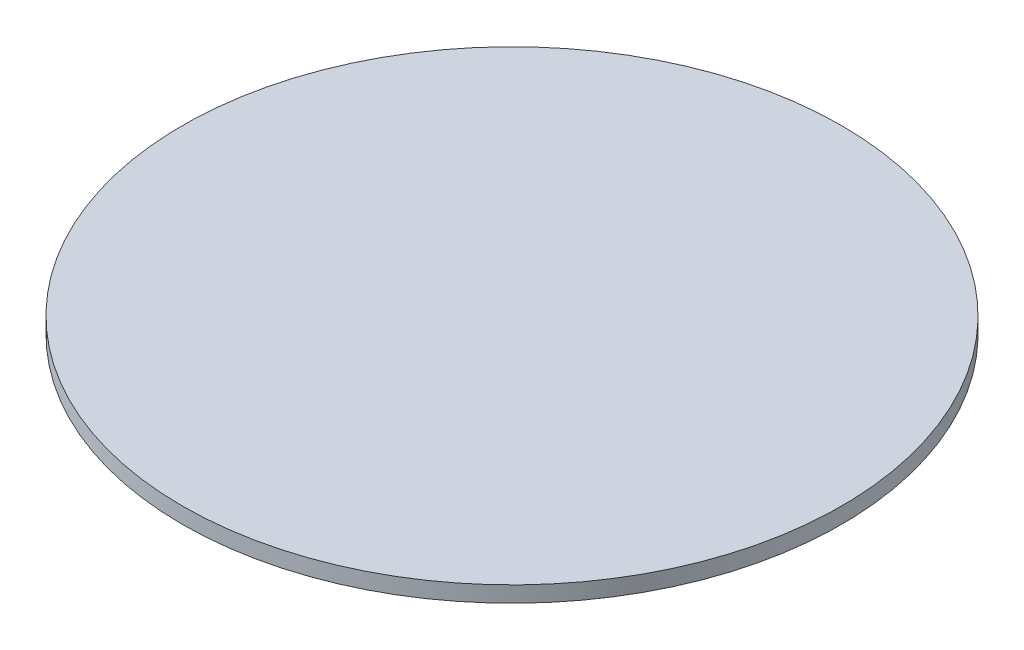
from build123d import *

# Parameters (mm, degrees)
SKETCH_1_R      = 62.09
EXTRUDE_1_DEPTH = 3


with BuildPart() as part:
    # 草图1 → 凸台-拉伸1 (new body)
    with BuildSketch(Plane(origin=(0, 0, 0), x_dir=(1, 0, 0), z_dir=(0, 1, 0))):
        with Locations(Location((0, 0, 0), (0, 0, 270))):
            Circle(SKETCH_1_R)
    extrude(amount=EXTRUDE_1_DEPTH)


solid = part.part
